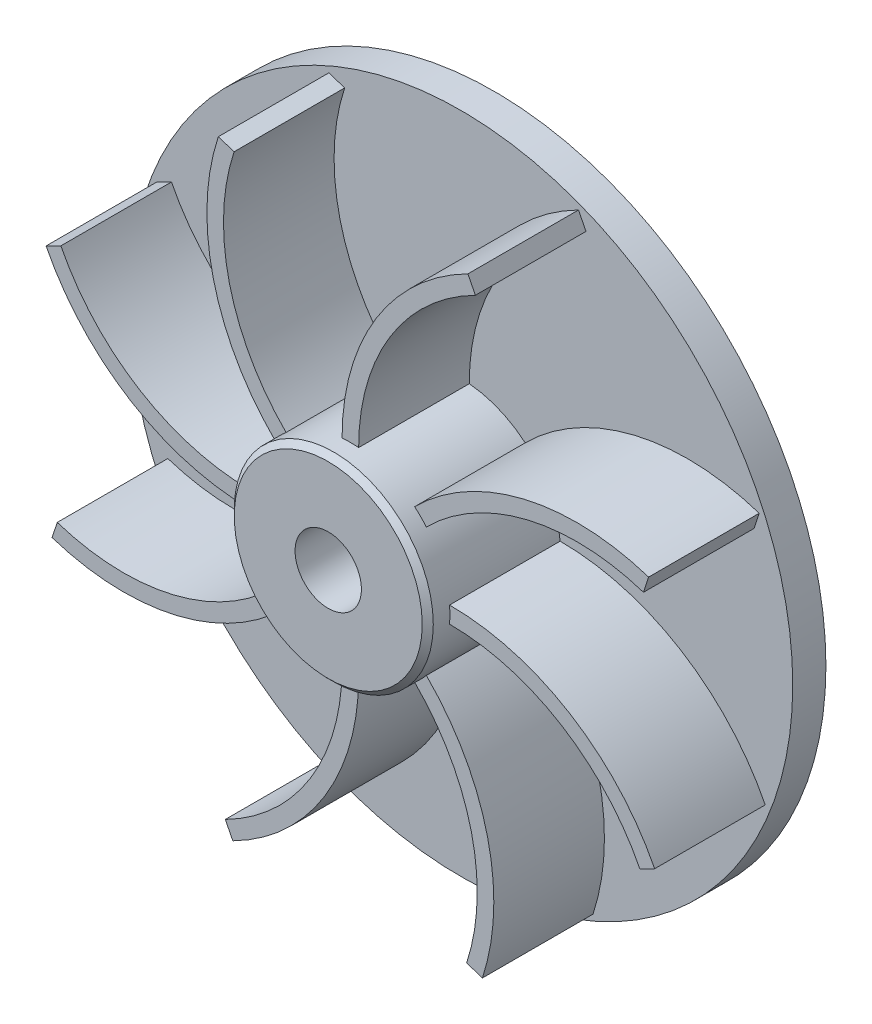
from build123d import *

# Parameters (mm, degrees)
SKETCH_1_R               = 60
EXTRUDE_1_DEPTH          = 6
SKETCH_2_R               = 18
EXTRUDE_2_DEPTH          = 30
EXTRUDE_3_DEPTH          = 20
PATTERN_CIRCULAR_1_COUNT = 8
SKETCH_4_R               = 6
CUT_EXTRUDE_1_DEPTH      = 91
CHAMFER_1_SIZE           = 1


with BuildPart() as part:
    # 草图1 → 凸台-拉伸1 (new body)
    with BuildSketch(Plane.XY):
        Circle(SKETCH_1_R)
    extrude(amount=EXTRUDE_1_DEPTH)

    # 草图2 → 凸台-拉伸2 (add)
    with BuildSketch(Plane.XY):
        Circle(SKETCH_2_R)
    extrude(amount=EXTRUDE_2_DEPTH)

    # 草图3 → 凸台-拉伸3 (add)
    with BuildSketch(Plane.XY.offset(6)):
        with BuildLine():
            Line((10.793600627, 0.86952175), (11.31454516, -2.084901509))
            ThreePointArc((11.31454516, -2.084901509), (35.223702528, -5.567543346), (52.349392529, -22.611232566))
            Line((52.349392529, -22.611232566), (55.025968571, -21.256263675))
            ThreePointArc((55.025968571, -21.256263675), (36.565809219, -2.884494776), (10.793600627, 0.86952175))
        make_face()
    extrude_3 = extrude(amount=EXTRUDE_3_DEPTH)

    # 阵列(圆周)1: 凸台-拉伸3 ×8 about axis
    pattern_circular_1_axis = Axis((0, 0, 31.5), (0, 0, -1))
    for i in range(1, PATTERN_CIRCULAR_1_COUNT):
        add(extrude_3.rotate(pattern_circular_1_axis, i * 360 / PATTERN_CIRCULAR_1_COUNT))

    # 草图4 → 切除-拉伸1 (cut, through all)
    with BuildSketch(Plane.XY.offset(30)):
        Circle(SKETCH_4_R)
    extrude(amount=-CUT_EXTRUDE_1_DEPTH, mode=Mode.SUBTRACT)

    # 倒角1
    chamfer_1_edges = [part.edges().sort_by_distance(p)[0] for p in [
        (-18, 0, 30),
    ]]
    chamfer(chamfer_1_edges, length=CHAMFER_1_SIZE)


solid = part.part
